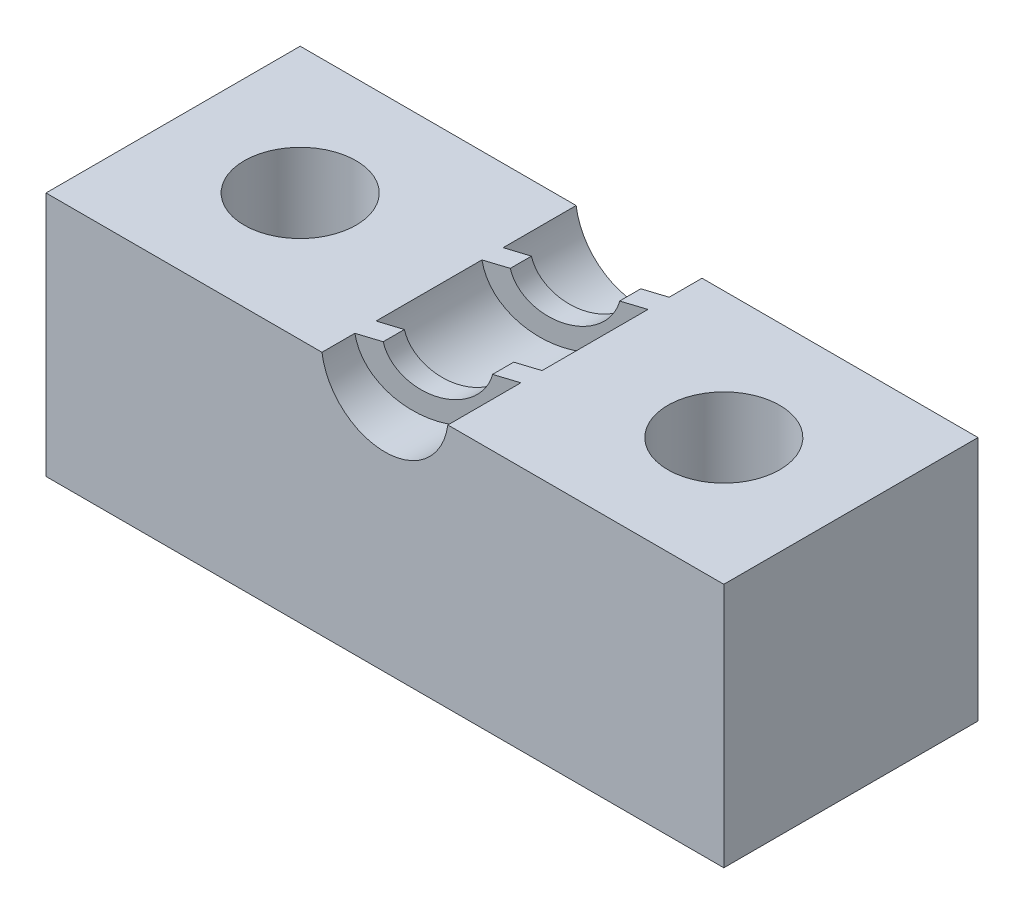
from build123d import *

# Parameters (mm, degrees)
SKETCH_1_W               = 16
SKETCH_1_H               = 12
SKETCH_1_R               = 1.5
EXTRUDE_1_DEPTH          = 3
EXTRUDE_2_DEPTH          = 6
CUT_EXTRUDE_2_DEPTH      = 11.440306509
CUT_EXTRUDE_2_DEPTH_BACK = 11.440306509
SKETCH_8_R               = 1.32
CUT_EXTRUDE_3_DEPTH      = 11.440306509


with BuildPart() as part:
    # 草图1 → 凸台-拉伸1 (new, symmetric)
    with BuildSketch(Plane.XY):
        Rectangle(SKETCH_1_W, SKETCH_1_H)
        Circle(SKETCH_1_R, mode=Mode.SUBTRACT)
    extrude(amount=EXTRUDE_1_DEPTH, both=True)

    # 草图6 → 凸台-拉伸2 (add)
    with BuildSketch(Plane(origin=(0, 0, 0), x_dir=(1, 0, 0), z_dir=(0, 1, 0))):
        Polygon((-1.5, -1.727557465), (-1.5, -2.227557465), (1.5, -1.272442535), (1.5, -0.772442535), align=None)
        Polygon((-1.5, 1.272442535), (-1.5, 0.772442535), (1.5, 1.727557465), (1.5, 2.227557465), align=None)
    extrude(amount=-EXTRUDE_2_DEPTH)

    # 草图7 → 切除-拉伸2 (cut, two sides: drawn at the far end of the back side and taken through both)
    with BuildSketch(Plane.XY.offset(-CUT_EXTRUDE_2_DEPTH_BACK)):
        with BuildLine():
            Line((-8, -0.203898058), (-0.978992126, -0.203898058))
            ThreePointArc((-0.978992126, -0.203898058), (-0.102488717, 0.994734167), (1, 0))
            ThreePointArc((1, 0), (0.994734167, -0.102488717), (0.978992126, -0.203898058))
            Line((0.978992126, -0.203898058), (8, -0.203898058))
            Line((8, -0.203898058), (8, 6))
            Line((8, 6), (-8, 6))
            Line((-8, 6), (-8, -0.203898058))
        make_face()
        with BuildLine():
            Line((0.978992126, -0.203898058), (0, 0))
            Line((0, 0), (-0.978992126, -0.203898058))
            ThreePointArc((-0.978992126, -0.203898058), (0, -1), (0.978992126, -0.203898058))
        make_face()
        with BuildLine():
            Line((-0.978992126, -0.203898058), (0, 0))
            Line((0, 0), (0.978992126, -0.203898058))
            ThreePointArc((0.978992126, -0.203898058), (0.994734167, -0.102488717), (1, 0))
            ThreePointArc((1, 0), (-0.102488717, 0.994734167), (-0.978992126, -0.203898058))
        make_face()
    extrude(amount=CUT_EXTRUDE_2_DEPTH + CUT_EXTRUDE_2_DEPTH_BACK, mode=Mode.SUBTRACT)

    # 草图8 → 切除-拉伸3 (cut, through all)
    with BuildSketch(Plane(origin=(0, 0, 0), x_dir=(1, 0, 0), z_dir=(0, 1, 0))):
        with Locations(Location((-5, 0, 0), (0, 0, 270))):
            Circle(SKETCH_8_R)
        with Locations(Location((5, 0, 0), (0, 0, 270))):
            Circle(SKETCH_8_R)
    extrude(amount=-CUT_EXTRUDE_3_DEPTH, mode=Mode.SUBTRACT)


solid = part.part
